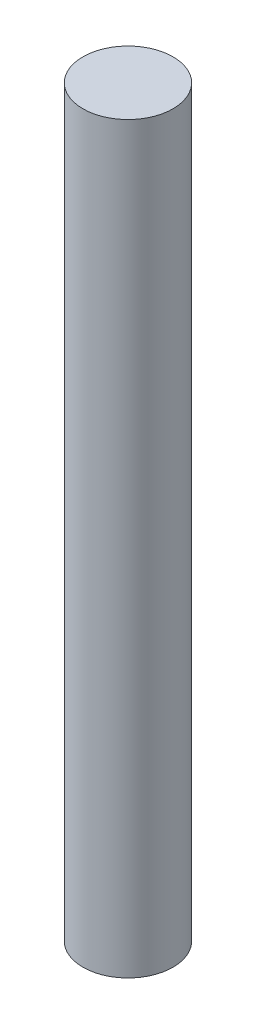
from build123d import *

# Parameters (mm, degrees)
SKETCH2_R           = 4
BOSS_EXTRUDE1_DEPTH = 33


with BuildPart() as part:
    # Sketch2 → Boss-Extrude1 (new, symmetric)
    with BuildSketch(Plane(origin=(0, 0, 0), x_dir=(1, 0, 0), z_dir=(0, 1, 0))):
        with Locations(Location((0, 0, 0), (0, 0, 270))):
            Circle(SKETCH2_R)
    extrude(amount=BOSS_EXTRUDE1_DEPTH, both=True)


solid = part.part
